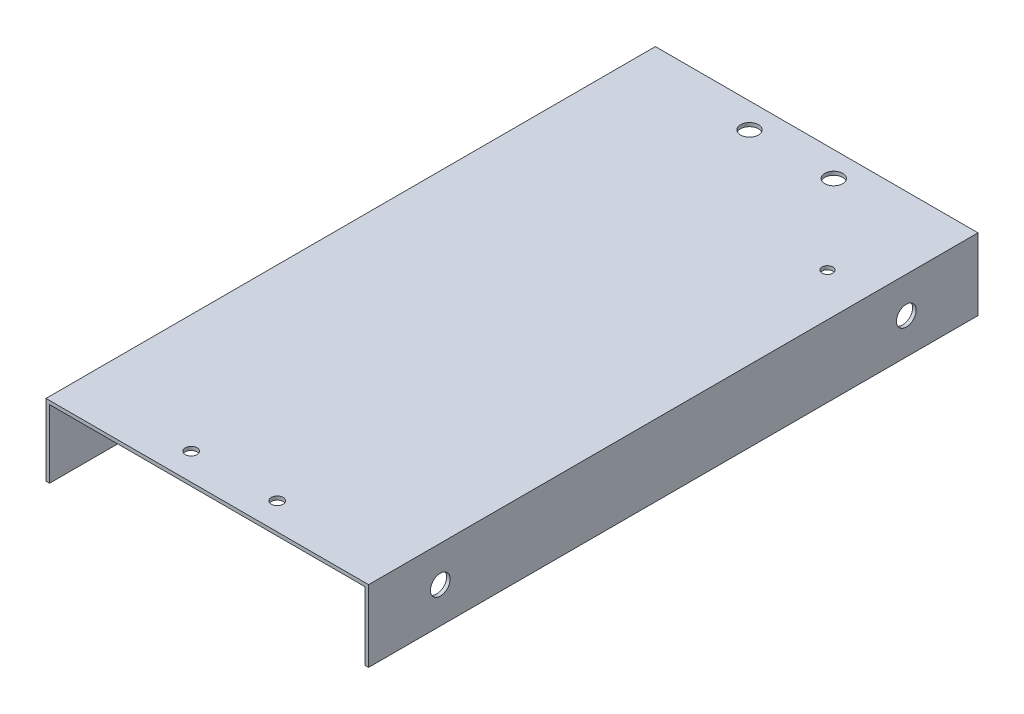
from build123d import *

# Parameters (mm, degrees)
BOSS_EXTRUDE1_DEPTH = 170
SKETCH2_R           = 2.75
CUT_EXTRUDE1_DEPTH  = 90
SKETCH3_R           = 1.65
CUT_EXTRUDE2_DEPTH  = 10
CUT_EXTRUDE3_REACH  = 178.989
SKETCH4_R           = 2.5
CUT_EXTRUDE4_REACH  = 178.989
SKETCH5_R           = 1.5


with BuildPart() as part:
    # Sketch1 → Boss-Extrude1 (new body)
    with BuildSketch(Plane.XY):
        Polygon((-45, 1), (-45, 21), (45, 21), (45, 1), (44, 1), (44, 20), (-44, 20), (-44, 1), align=None)
    extrude(amount=-BOSS_EXTRUDE1_DEPTH)

    # Sketch2 → Cut-Extrude1 (cut)
    with BuildSketch(Plane.ZY.offset(45)):
        with Locations((-150, 11)):
            Circle(SKETCH2_R)
        with Locations((-20, 11)):
            Circle(SKETCH2_R)
    extrude(amount=-CUT_EXTRUDE1_DEPTH, mode=Mode.SUBTRACT)

    # Sketch3 → Cut-Extrude2 (cut)
    with BuildSketch(Plane(origin=(0, 21, 0), x_dir=(1, 0, 0), z_dir=(0, 1, 0))):
        with Locations(Location((12, 7.5, 0), (0, 0, 270))):
            Circle(SKETCH3_R)
        with Locations((-12, 7.5)):
            Circle(SKETCH3_R)
    extrude(amount=-CUT_EXTRUDE2_DEPTH, mode=Mode.SUBTRACT)

    # Sketch4 → Cut-Extrude3 (cut, up to next)
    with BuildSketch(Plane(origin=(0, 21, 0), x_dir=(1, 0, 0), z_dir=(0, 1, 0)), mode=Mode.PRIVATE) as cut_extrude3_sk1:
        with Locations(Location((-11.75, 163, 0), (0, 0, 270))):
            Circle(SKETCH4_R)
    cut_extrude3_tool1 = extrude(cut_extrude3_sk1.sketch, amount=-CUT_EXTRUDE3_REACH, mode=Mode.PRIVATE) & part.part
    # Sketch4 → Cut-Extrude3 (cut, up to next)
    with BuildSketch(Plane(origin=(0, 21, 0), x_dir=(1, 0, 0), z_dir=(0, 1, 0)), mode=Mode.PRIVATE) as cut_extrude3_sk2:
        with Locations((11.75, 163)):
            Circle(SKETCH4_R)
    cut_extrude3_tool2 = extrude(cut_extrude3_sk2.sketch, amount=-CUT_EXTRUDE3_REACH, mode=Mode.PRIVATE) & part.part
    add(cut_extrude3_tool1.solids().sort_by_distance((-11.75, 21, -163))[0], mode=Mode.SUBTRACT)
    add(cut_extrude3_tool2.solids().sort_by_distance((11.75, 21, -163))[0], mode=Mode.SUBTRACT)

    # Sketch5 → Cut-Extrude4 (cut, up to next)
    with BuildSketch(Plane(origin=(0, 21, 0), x_dir=(1, 0, 0), z_dir=(0, 1, 0)), mode=Mode.PRIVATE) as cut_extrude4_sk1:
        with Locations(Location((33, 140, 0), (0, 0, 270))):
            Circle(SKETCH5_R)
    cut_extrude4_tool1 = extrude(cut_extrude4_sk1.sketch, amount=-CUT_EXTRUDE4_REACH, mode=Mode.PRIVATE) & part.part
    add(cut_extrude4_tool1.solids().sort_by_distance((33, 21, -140))[0], mode=Mode.SUBTRACT)


solid = part.part
